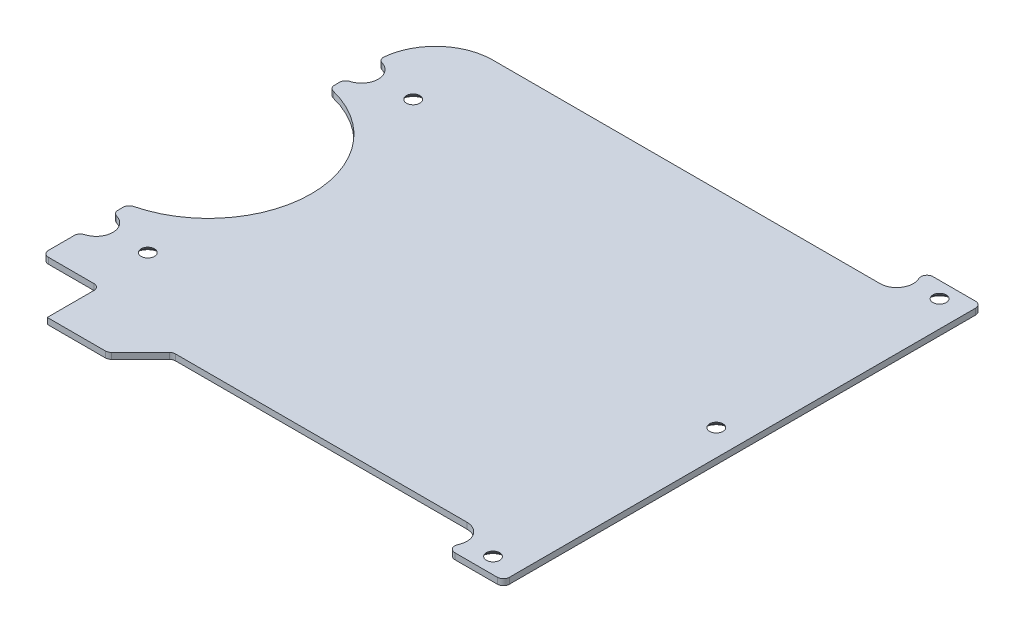
from build123d import *

# Parameters (mm, degrees)
SKETCH1_R                  = 1
BASE_SHAPE_DEPTH           = 1
FILLETS_R                  = 1
M2_COUNTERSUNKS_AT_2_COUNT = 2
M2_COUNTERSUNKS_AT_2_PITCH = 73.76
M2_COUNTERSUNKS_AT_3_COUNT = 2
M2_COUNTERSUNKS_AT_3_PITCH = 73.537756289
M2_COUNTERSUNKS_AT_4_COUNT = 2
M2_COUNTERSUNKS_AT_4_PITCH = 92.959345953
M2_COUNTERSUNKS_AT_5_COUNT = 2
M2_COUNTERSUNKS_AT_5_PITCH = 36.88


with BuildPart() as part:
    # Sketch1 → Base shape (new body)
    with BuildSketch(Plane(origin=(0, 0, 0), x_dir=(1, 0, 0), z_dir=(0, 1, 0))):
        with BuildLine():
            ThreePointArc((2.75, 36.88), (1.944543648, 34.935456352), (0, 34.13))
            Line((0, 34.13), (-63.992025159, 34.13))
            ThreePointArc((-63.992025159, 34.13), (-70.681255309, 31.35923015), (-73.452025159, 24.67))
            ThreePointArc((-73.452025159, 24.67), (-71.507481511, 23.864543648), (-70.702025159, 21.92))
            ThreePointArc((-70.702025159, 21.92), (-71.507481511, 19.975456352), (-73.452025159, 19.17))
            Line((-73.452025159, 19.17), (-73.452025159, 16.662625843))
            ThreePointArc((-73.452025159, 16.662625843), (-63.663567803, 10.763596053), (-59.822025159, 0))
            ThreePointArc((-59.822025159, 0), (-63.663567803, -10.763596053), (-73.452025159, -16.662625843))
            Line((-73.452025159, -16.662625843), (-73.452025159, -19.17))
            ThreePointArc((-73.452025159, -19.17), (-71.507481511, -19.975456352), (-70.702025159, -21.92))
            ThreePointArc((-70.702025159, -21.92), (-71.507481511, -23.864543648), (-73.452025159, -24.67))
            Line((-73.452025159, -24.67), (-73.452025159, -30.8))
            Line((-73.452025159, -30.8), (-63.952025159, -30.8))
            Line((-63.952025159, -30.8), (-63.952025159, -34.13))
            Line((-63.952025159, -34.13), (-63.952025159, -39.5))
            Line((-63.952025159, -39.5), (-53.952025159, -39.5))
            Line((-53.952025159, -39.5), (-48.582025159, -34.13))
            Line((-48.582025159, -34.13), (0, -34.13))
            ThreePointArc((0, -34.13), (1.944543648, -34.935456352), (2.75, -36.88))
            ThreePointArc((2.75, -36.88), (2.220381771, -38.502468734), (0.835523788, -39.5))
            Line((0.835523788, -39.5), (11.4, -39.5))
            Line((11.4, -39.5), (11.4, 39.5))
            Line((11.4, 39.5), (0.835523788, 39.5))
            ThreePointArc((0.835523788, 39.5), (2.220381771, 38.502468734), (2.75, 36.88))
        make_face()
        with Locations(Location((-64.925, -21.92, 0), (0, 0, 270))):
            Circle(SKETCH1_R, mode=Mode.SUBTRACT)
        with Locations(Location((7.075, -36.88, 0), (0, 0, 270))):
            Circle(SKETCH1_R, mode=Mode.SUBTRACT)
        with Locations(Location((-64.925, 21.92, 0), (0, 0, 270))):
            Circle(SKETCH1_R, mode=Mode.SUBTRACT)
        with Locations(Location((7.075, 0, 0), (0, 0, 270))):
            Circle(SKETCH1_R, mode=Mode.SUBTRACT)
        with Locations(Location((7.075, 36.88, 0), (0, 0, 270))):
            Circle(SKETCH1_R, mode=Mode.SUBTRACT)
    extrude(amount=BASE_SHAPE_DEPTH)

    # Fillets
    fillets_edges = [part.edges().sort_by_distance(p)[0] for p in [
        (0.835523788, 0.5, -39.5),
        (11.4, 0.5, -39.5),
        (11.4, 0.5, 39.5),
        (0.835523788, 0.5, 39.5),
        (-48.582025159, 0.5, 34.13),
        (-53.952025159, 0.5, 39.5),
        (-63.952025159, 0.5, 30.8),
        (-73.452025159, 0.5, 30.8),
        (-73.452025159, 0.5, 24.67),
        (-73.452025159, 0.5, 19.17),
        (-73.452025159, 0.5, 16.662625843),
        (-73.452025159, 0.5, -16.662625843),
        (-73.452025159, 0.5, -19.17),
        (-73.452025159, 0.5, -24.67),
    ]]
    fillet(fillets_edges, radius=FILLETS_R)

    # Sketch3 → M2 countersunks (revolve, cut)
    with BuildSketch(Plane(origin=(7.075, 0, -36.88), x_dir=(0, 0, -1), z_dir=(1, 0, 0))):
        Polygon((0, 0), (0, 1), (1, 1), (1, 1.1), (2, 0.1), (2, 0), align=None)
    m2_countersunks = revolve(axis=Axis((7.075, -6.35, -36.88), (0, 1, 0)), mode=Mode.SUBTRACT)

    # M2 countersunks at 2: M2 countersunks ×2
    with Locations(*[(0, 0, i * M2_COUNTERSUNKS_AT_2_PITCH) for i in range(1, M2_COUNTERSUNKS_AT_2_COUNT)]):
        add(m2_countersunks, mode=Mode.SUBTRACT)

    # M2 countersunks at 3: M2 countersunks ×2
    with Locations(*[Vector(-0.9790888875801275, 0, 0.2034329133083154) * (i * M2_COUNTERSUNKS_AT_3_PITCH) for i in range(1, M2_COUNTERSUNKS_AT_3_COUNT)]):
        add(m2_countersunks, mode=Mode.SUBTRACT)

    # M2 countersunks at 4: M2 countersunks ×2
    with Locations(*[Vector(-0.7745321275866415, 0, 0.6325345708624239) * (i * M2_COUNTERSUNKS_AT_4_PITCH) for i in range(1, M2_COUNTERSUNKS_AT_4_COUNT)]):
        add(m2_countersunks, mode=Mode.SUBTRACT)

    # M2 countersunks at 5: M2 countersunks ×2
    with Locations(*[(0, 0, i * M2_COUNTERSUNKS_AT_5_PITCH) for i in range(1, M2_COUNTERSUNKS_AT_5_COUNT)]):
        add(m2_countersunks, mode=Mode.SUBTRACT)


solid = part.part
